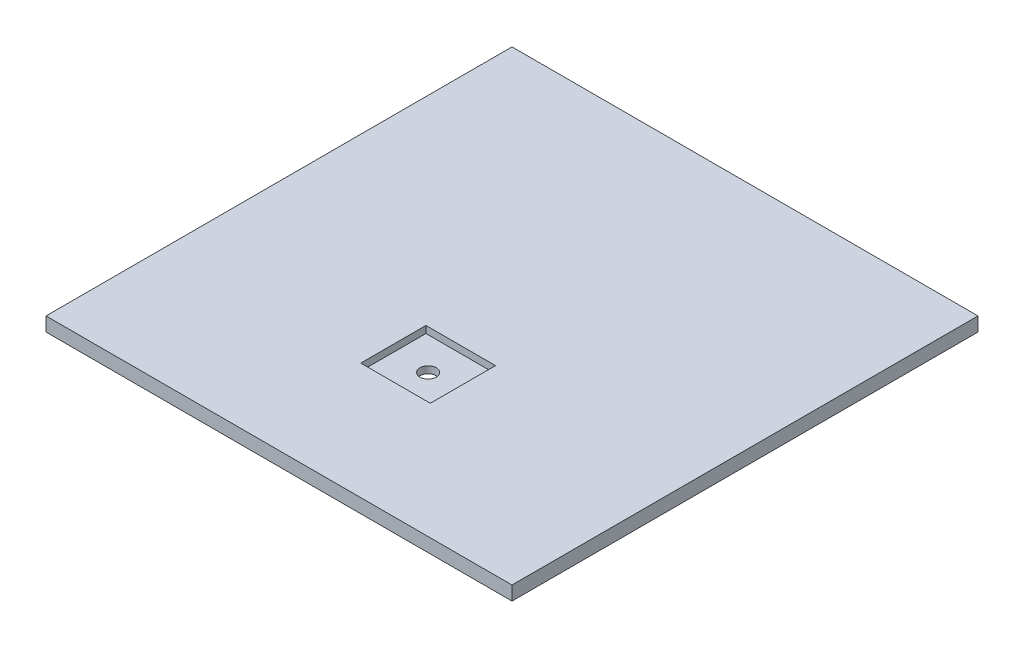
from build123d import *

# Parameters (mm, degrees)
SKETCH1_W           = 100
SKETCH1_H           = 100
SKETCH1_R           = 1.75
BOSS_EXTRUDE1_DEPTH = 3
SKETCH2_W           = 14.924484516
SKETCH2_H           = 13.991704233
CUT_EXTRUDE1_DEPTH  = 1.5


with BuildPart() as part:
    # Sketch1 → Boss-Extrude1 (new body)
    with BuildSketch(Plane(origin=(0, 0, 0), x_dir=(1, 0, 0), z_dir=(0, 1, 0))):
        with Locations((12.953774531, 8.385212888)):
            Rectangle(SKETCH1_W, SKETCH1_H)
        with Locations(Location((12.953774531, -9.614787112, 0), (0, 0, 270))):
            Circle(SKETCH1_R, mode=Mode.SUBTRACT)
    extrude(amount=BOSS_EXTRUDE1_DEPTH)

    # Sketch2 → Cut-Extrude1 (cut)
    with BuildSketch(Plane(origin=(0, 3, 0), x_dir=(1, 0, 0), z_dir=(0, 1, 0))):
        with Locations((12.953774531, -9.614787112)):
            Rectangle(SKETCH2_W, SKETCH2_H)
    extrude(amount=-CUT_EXTRUDE1_DEPTH, mode=Mode.SUBTRACT)


solid = part.part
